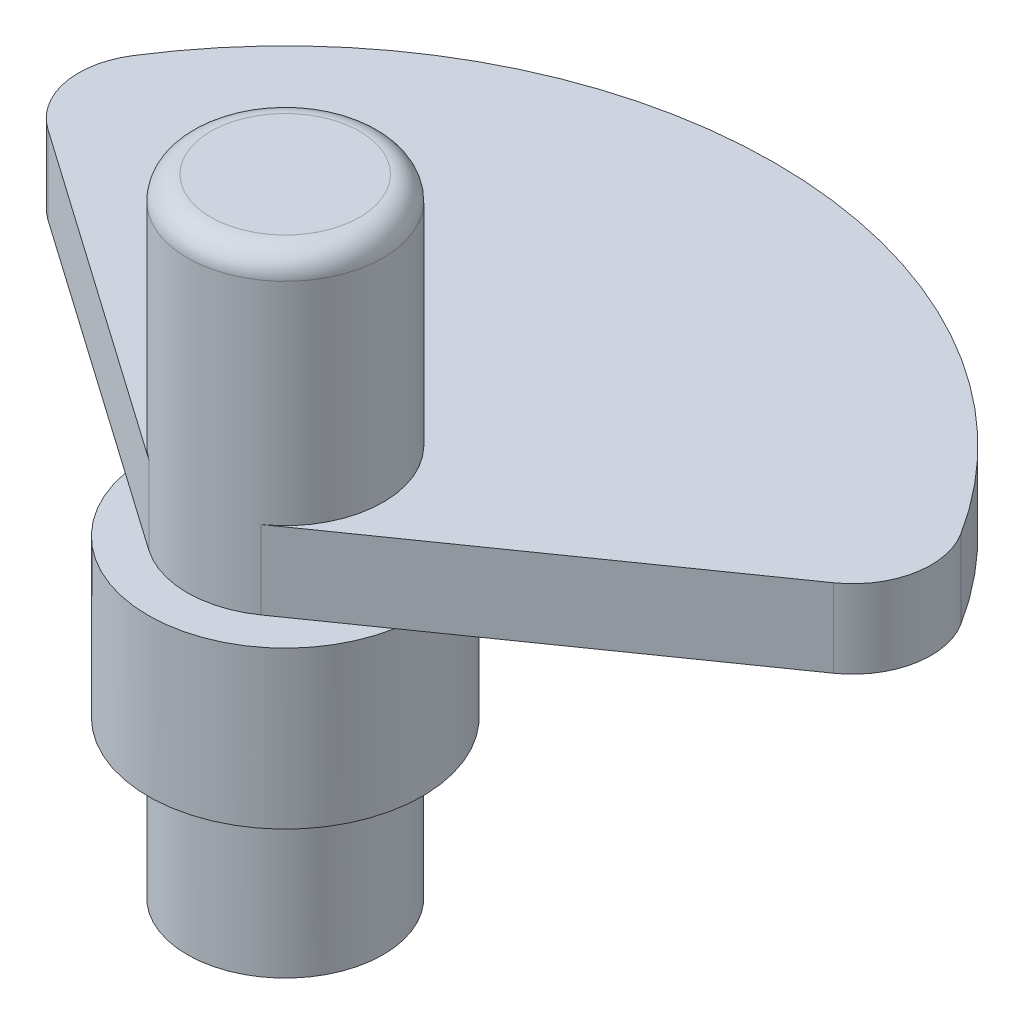
from build123d import *

# Parameters (mm, degrees)
BOSS_EXTRUDE1_DEPTH      = 10
BOSS_EXTRUDE2_DEPTH      = 30
BOSS_EXTRUDE2_DEPTH_BACK = 50
SKETCH2_R                = 12.5
SKETCH3_R                = 17.5
BOSS_EXTRUDE3_DEPTH      = 20
FILLET1_R                = 3
SKETCH4_R                = 1.5
CUT_EXTRUDE1_DEPTH       = 10


with BuildPart() as part:
    # Sketch1 → Boss-Extrude1 (new body)
    with BuildSketch(Plane(origin=(0, 0, 0), x_dir=(1, 0, 0), z_dir=(0, 1, 0))):
        with BuildLine():
            Line((-50.126401, 19.839202), (-7.169705, -10.239401))
            ThreePointArc((-7.169705, -10.239401), (0, -12.5), (7.169705, -10.239401))
            Line((7.169705, -10.239401), (50.126401, 19.839202))
            ThreePointArc((50.126401, 19.839202), (54.194564, 26.060188), (52.845996, 33.369907))
            ThreePointArc((52.845996, 33.369907), (0, 62.5), (-52.845996, 33.369907))
            ThreePointArc((-52.845996, 33.369907), (-54.194564, 26.060188), (-50.126401, 19.839202))
        make_face()
    extrude(amount=BOSS_EXTRUDE1_DEPTH)

    # Sketch2 → Boss-Extrude2 (add, two sides: drawn at the far end of the back side and taken through both)
    with BuildSketch(Plane(origin=(0, 10, 0), x_dir=(1, 0, 0), z_dir=(0, 1, 0)).offset(-BOSS_EXTRUDE2_DEPTH_BACK)):
        with Locations(Location((0, 0, 0), (0, 0, 270))):
            Circle(SKETCH2_R)
    extrude(amount=BOSS_EXTRUDE2_DEPTH + BOSS_EXTRUDE2_DEPTH_BACK)

    # Sketch3 → Boss-Extrude3 (add)
    with BuildSketch(Plane.XZ):
        with Locations(Location((0, 0, 0), (0, 0, 169.415309))):
            Circle(SKETCH3_R)
    extrude(amount=BOSS_EXTRUDE3_DEPTH)

    # Fillet1
    fillet1_edges = [part.edges().sort_by_distance(p)[0] for p in [
        (0, 40, -12.5),
    ]]
    fillet(fillet1_edges, radius=FILLET1_R)

    # Sketch4 → Cut-Extrude1 (cut)
    with BuildSketch(Plane.XZ.offset(40)):
        with Locations(Location((0, 9, 0), (0, 0, 270))):
            Circle(SKETCH4_R)
        with Locations(Location((9, 0, 0), (0, 0, 270))):
            Circle(SKETCH4_R)
        with Locations(Location((0, -9, 0), (0, 0, 270))):
            Circle(SKETCH4_R)
        with Locations(Location((-9, 0, 0), (0, 0, 270))):
            Circle(SKETCH4_R)
    extrude(amount=-CUT_EXTRUDE1_DEPTH, mode=Mode.SUBTRACT)


solid = part.part
